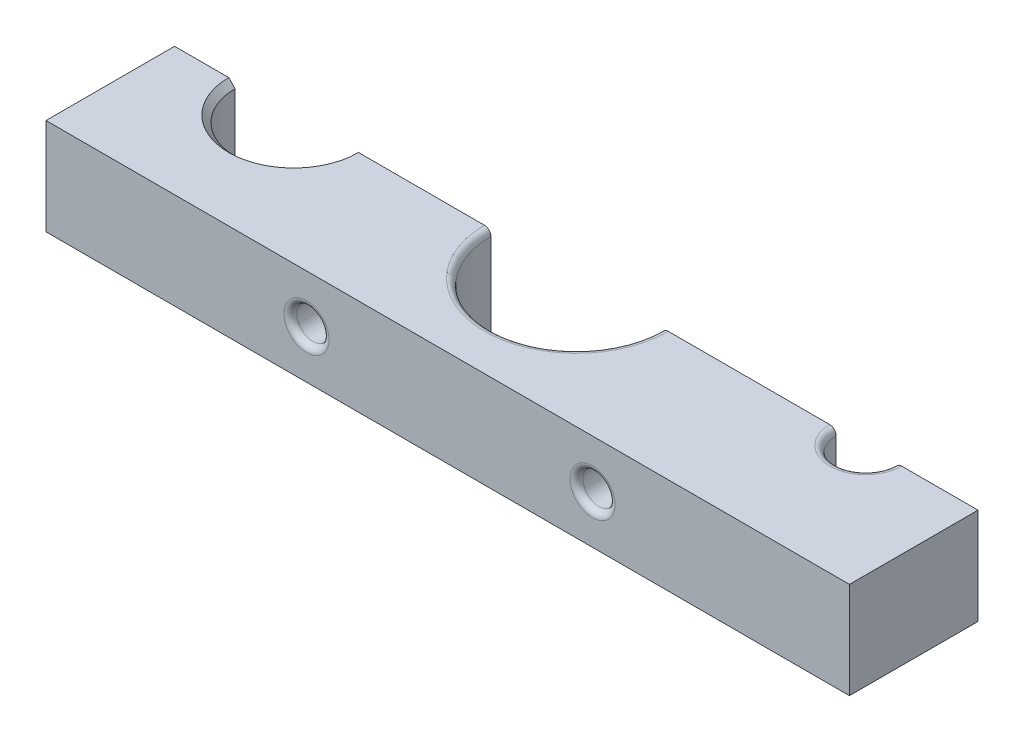
from build123d import *

# Parameters (mm, degrees)
SKETCH_1_W          = 125
SKETCH_1_H          = 40
EXTRUDE_1_DEPTH     = 15
SKETCH_2_R          = 9.1
SKETCH_2_R_2        = 4.6
SKETCH_2_R_3        = 13.3
CUT_EXTRUDE_1_DEPTH = 133.098448136
CHAMFER_1_SIZE      = 1
CHAMFER_2_SIZE      = 1
FILLET_1_R          = 1
SKETCH_3_R          = 2.5
CUT_EXTRUDE_2_DEPTH = 133.098448136
FILLET_2_R          = 1
SKETCH_5_W          = 130.4461144
SKETCH_5_H          = 31.847563365
CUT_EXTRUDE_3_DEPTH = 133.098448178


with BuildPart() as part:
    # 草圖1 → 填料-伸長1 (new body)
    with BuildSketch(Plane(origin=(0, 0, 0), x_dir=(1, 0, 0), z_dir=(0, 1, 0))):
        with Locations((62.5, 20)):
            Rectangle(SKETCH_1_W, SKETCH_1_H)
    extrude(amount=EXTRUDE_1_DEPTH)

    # 草圖2 → 除料-伸長1 (cut, through all)
    with BuildSketch(Plane(origin=(0, 15, 0), x_dir=(1, 0, 0), z_dir=(0, 1, 0))):
        with Locations(Location((18.526668527, 20, 0), (0, 0, 270))):
            Circle(SKETCH_2_R)
        with Locations(Location((107.526668527, 20, 0), (0, 0, 270))):
            Circle(SKETCH_2_R_2)
        with Locations(Location((62.526668527, 20, 0), (0, 0, 270))):
            Circle(SKETCH_2_R_3)
    extrude(amount=-CUT_EXTRUDE_1_DEPTH, mode=Mode.SUBTRACT)

    # 導角1
    chamfer_1_edges = [part.edges().sort_by_distance(p)[0] for p in [
        (18.526668527, 15, -29.1),
    ]]
    chamfer(chamfer_1_edges, length=CHAMFER_1_SIZE)

    # 導角2
    chamfer_2_edges = [part.edges().sort_by_distance(p)[0] for p in [
        (18.526668527, 0, -29.1),
    ]]
    chamfer(chamfer_2_edges, length=CHAMFER_2_SIZE)

    # 圓角1
    fillet_1_edges = [part.edges().sort_by_distance(p)[0] for p in [
        (107.526668527, 0, -24.6),
        (107.526668527, 15, -24.6),
        (62.526668527, 0, -33.3),
        (62.526668527, 15, -33.3),
    ]]
    fillet(fillet_1_edges, radius=FILLET_1_R)

    # 草圖3 → 除料-伸長2 (cut, through all)
    with BuildSketch(Plane.XY):
        with Locations((40.53, 7.5)):
            Circle(SKETCH_3_R)
        with Locations((85.03, 7.5)):
            Circle(SKETCH_3_R)
    extrude(amount=-CUT_EXTRUDE_2_DEPTH, mode=Mode.SUBTRACT)

    # 圓角2
    fillet_2_edges = [part.edges().sort_by_distance(p)[0] for p in [
        (38.03, 7.5, -40),
        (38.03, 7.5, 0),
        (82.53, 7.5, -40),
        (82.53, 7.5, 0),
    ]]
    fillet(fillet_2_edges, radius=FILLET_2_R)

    # 草圖5 → 除料-伸長3 (cut, through all)
    with BuildSketch(Plane(origin=(0, 15, 0), x_dir=(1, 0, 0), z_dir=(0, 1, 0))):
        with Locations((65.2230572, 35.923781683)):
            Rectangle(SKETCH_5_W, SKETCH_5_H)
    extrude(amount=-CUT_EXTRUDE_3_DEPTH, mode=Mode.SUBTRACT)


solid = part.part
